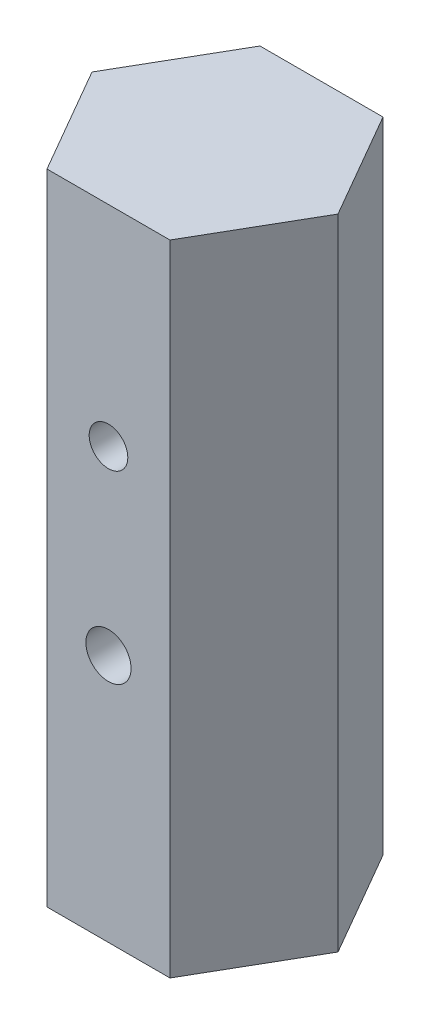
from build123d import *

# Parameters (mm, degrees)
BOSS_EXTRUDE1_DEPTH              = 57.15
F_1_2_0_5_DIAMETER_HOLE1_D       = 12.7
F_1_2_0_5_DIAMETER_HOLE1_DEPTH   = 45.72
F_1_2_0_5_DIAMETER_HOLE1_TIP     = 3.815464931
F_10_32_TAPPED_HOLE1_REACH       = 63.237
F_10_32_TAPPED_HOLE1_BORE_R      = 2.0193
F_29_0_136_DIAMETER_HOLE1_REACH  = 63.237
F_29_0_136_DIAMETER_HOLE1_BORE_R = 1.7272


with BuildPart() as part:
    # Sketch1 → Boss-Extrude1 (new body)
    with BuildSketch(Plane(origin=(0, 0, 0), x_dir=(1, 0, 0), z_dir=(0, 1, 0))):
        Polygon((5.499261314, -9.525), (10.998522628, 0), (5.499261314, 9.525), (-5.499261314, 9.525), (-10.998522628, 0), (-5.499261314, -9.525), align=None)
    extrude(amount=BOSS_EXTRUDE1_DEPTH)

    # 1/2 (0.5) Diameter Hole1
    with Locations(Plane(origin=(0, 0, 0), x_dir=(-1, 0, 0), z_dir=(0, -1, 0))):
        with Locations((0, 0)):
            Hole(F_1_2_0_5_DIAMETER_HOLE1_D / 2, depth=F_1_2_0_5_DIAMETER_HOLE1_DEPTH)
            with Locations((0, 0, -(F_1_2_0_5_DIAMETER_HOLE1_DEPTH + F_1_2_0_5_DIAMETER_HOLE1_TIP / 2))):  # 118° drill point
                Cone(0, F_1_2_0_5_DIAMETER_HOLE1_D / 2, F_1_2_0_5_DIAMETER_HOLE1_TIP, mode=Mode.SUBTRACT)

    # #10-32 Tapped Hole1 bore → #10-32 Tapped Hole1 (cut, up to next)
    with BuildSketch(Plane.XY.offset(9.525), mode=Mode.PRIVATE) as f_10_32_tapped_hole1_sk1:
        with Locations((0, 22.225)):
            Circle(F_10_32_TAPPED_HOLE1_BORE_R)
    f_10_32_tapped_hole1_tool1 = extrude(f_10_32_tapped_hole1_sk1.sketch, amount=-F_10_32_TAPPED_HOLE1_REACH, mode=Mode.PRIVATE) & part.part
    add(f_10_32_tapped_hole1_tool1.solids().sort_by_distance((0, 22.225, 9.525))[0], mode=Mode.SUBTRACT)

    # #29 (0.136) Diameter Hole1 bore → #29 (0.136) Diameter Hole1 (cut, up to next)
    with BuildSketch(Plane.XY.offset(9.525), mode=Mode.PRIVATE) as f_29_0_136_diameter_hole1_sk1:
        with Locations((0, 38.4175)):
            Circle(F_29_0_136_DIAMETER_HOLE1_BORE_R)
    f_29_0_136_diameter_hole1_tool1 = extrude(f_29_0_136_diameter_hole1_sk1.sketch, amount=-F_29_0_136_DIAMETER_HOLE1_REACH, mode=Mode.PRIVATE) & part.part
    add(f_29_0_136_diameter_hole1_tool1.solids().sort_by_distance((0, 38.4175, 9.525))[0], mode=Mode.SUBTRACT)


solid = part.part
